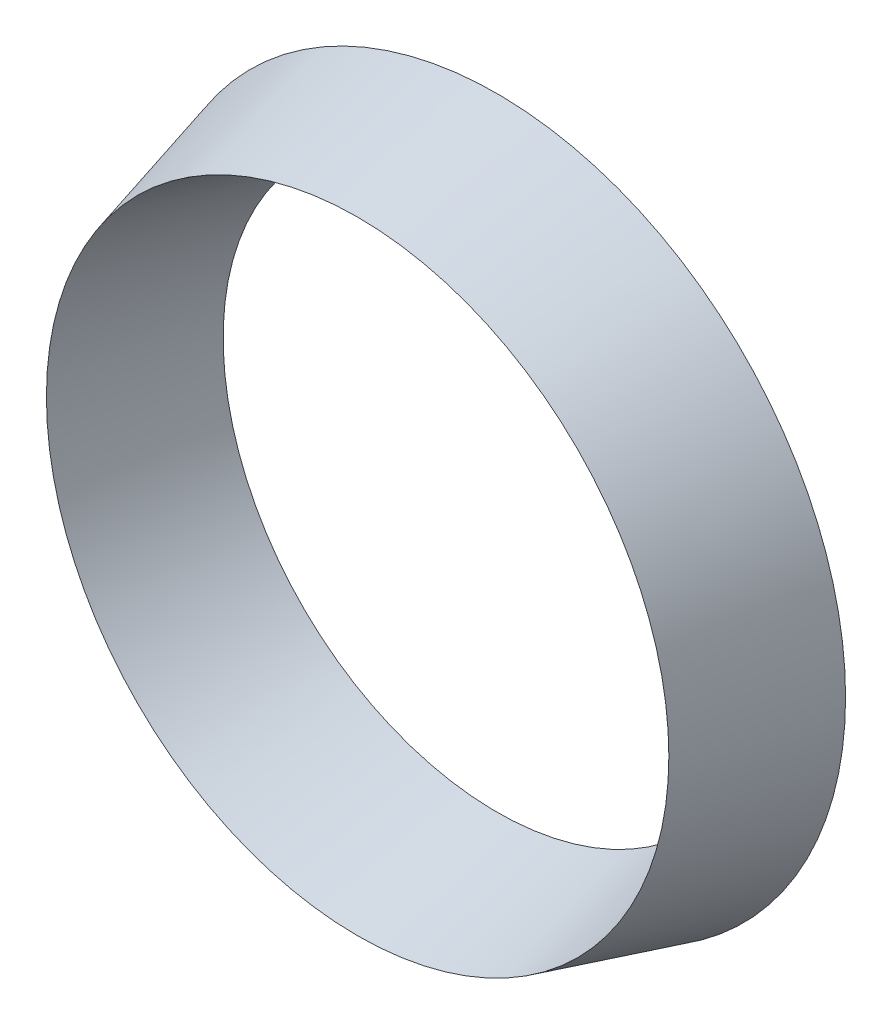
from build123d import *

# Parameters (mm, degrees)
ESQUISSE1_R        = 28
ESQUISSE1_R_2      = 22
BOSS_EXTRU_1_DEPTH = 70
BOSS_EXTRU_1_TAPER = 15


with BuildPart() as part:
    # Esquisse1 → Boss.-Extru.1 (new body)
    with BuildSketch(Plane.XY):
        Circle(ESQUISSE1_R)
        Circle(ESQUISSE1_R_2, mode=Mode.SUBTRACT)
    extrude(amount=BOSS_EXTRU_1_DEPTH, taper=BOSS_EXTRU_1_TAPER)


solid = part.part
